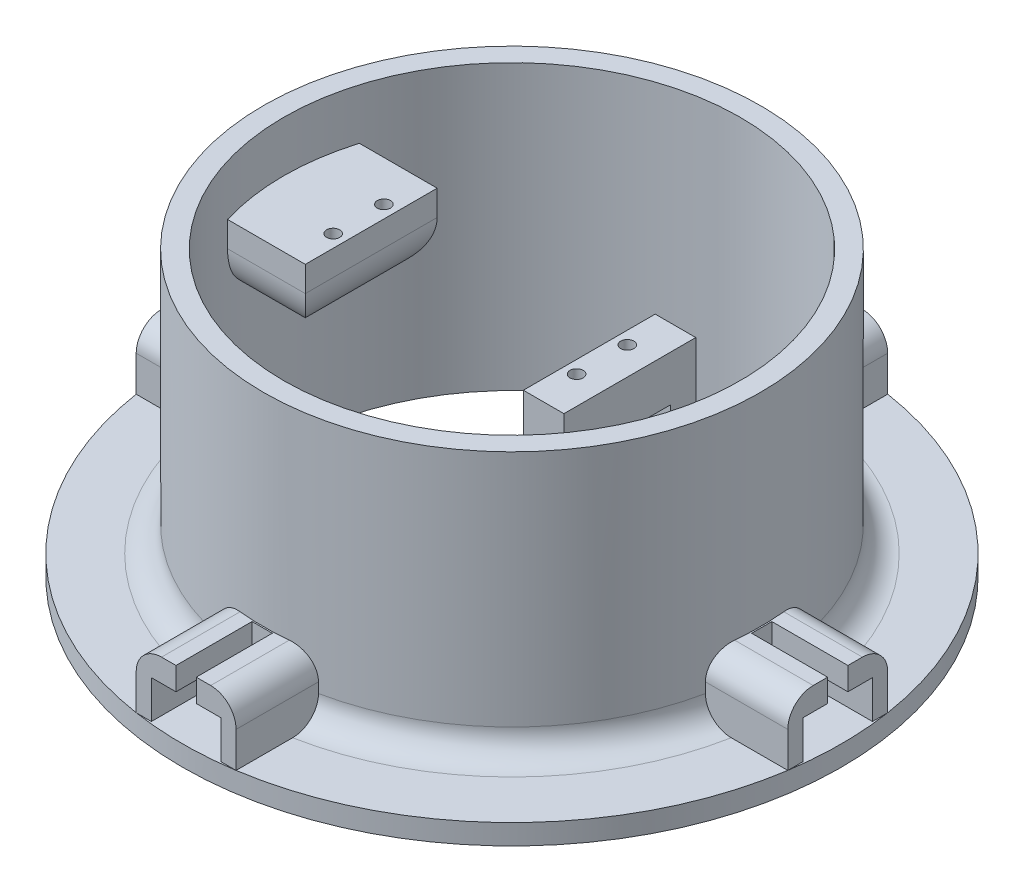
from build123d import *

# Parameters (mm, degrees)
CROQUIS1_R              = 49
CROQUIS1_R_2            = 45
SALIENTE_EXTRUIR1_DEPTH = 56
CROQUIS3_R              = 65
CROQUIS3_R_2            = 49
SALIENTE_EXTRUIR2_DEPTH = 4
REDONDEO1_R             = 5
CROQUIS4_W              = 8
CROQUIS4_H              = 26
SALIENTE_EXTRUIR3_DEPTH = 46
SALIENTE_EXTRUIR4_DEPTH = 2.2
SALIENTE_EXTRUIR5_START = -15
SALIENTE_EXTRUIR5_DEPTH = 15
REDONDEO2_R             = 10
CROQUIS7_R              = 1.3
CORTAR_EXTRUIR1_DEPTH   = 7.2
CORTAR_EXTRUIR2_REACH   = 119.478
CROQUIS8_W              = 16
CROQUIS8_H              = 34
CROQUIS9_W              = 16.249513617
CROQUIS9_H              = 19.697715604
SALIENTE_EXTRUIR6_DEPTH = 12
REDONDEO3_R             = 5
CROQUIS11_W             = 13.697715604
CROQUIS11_H             = 7.5
CORTAR_EXTRUIR3_DEPTH   = 12
CROQUIS12_W             = 4
CROQUIS12_H             = 4.5
CORTAR_EXTRUIR4_DEPTH   = 15
MATRIZC1_COUNT          = 4
REDONDEO3_OF_MATRIZC1_R = 5


with BuildPart() as part:
    # Croquis1 → Saliente-Extruir1 (new body)
    with BuildSketch(Plane(origin=(0, 0, 0), x_dir=(1, 0, 0), z_dir=(0, 1, 0))):
        with Locations(Location((0, 0, 0), (0, 0, 270))):
            Circle(CROQUIS1_R)
        with Locations(Location((0, 0, 0), (0, 0, 270))):
            Circle(CROQUIS1_R_2, mode=Mode.SUBTRACT)
    extrude(amount=SALIENTE_EXTRUIR1_DEPTH)

    # Croquis3 → Saliente-Extruir2 (add)
    with BuildSketch(Plane(origin=(0, 0, 0), x_dir=(1, 0, 0), z_dir=(0, 1, 0))):
        with Locations(Location((0, 0, 0), (0, 0, 270))):
            Circle(CROQUIS3_R)
        with Locations(Location((0, 0, 0), (0, 0, 270))):
            Circle(CROQUIS3_R_2, mode=Mode.SUBTRACT)
    extrude(amount=SALIENTE_EXTRUIR2_DEPTH)

    # Redondeo1
    redondeo1_edges = [part.edges().sort_by_distance(p)[0] for p in [
        (0, 4, -49),
    ]]
    fillet(redondeo1_edges, radius=REDONDEO1_R)



with BuildPart() as body_2:
    # Croquis4 → Saliente-Extruir3 (new body)
    with BuildSketch(Plane(origin=(0, 0, 0), x_dir=(1, 0, 0), z_dir=(0, 1, 0))):
        with Locations((19.25, 0)):
            Rectangle(CROQUIS4_W, CROQUIS4_H)
    extrude(amount=SALIENTE_EXTRUIR3_DEPTH)


with BuildPart() as part_1:
    add(part.part)

    add(body_2.part)  # Saliente-Extruir4 merges body 2
    # Croquis5 → Saliente-Extruir4 (add)
    with BuildSketch(Plane(origin=(0, 0, 0), x_dir=(1, 0, 0), z_dir=(0, 1, 0))):
        with BuildLine():
            Line((15.25, 13), (32.749541701, 30.86207249))
            ThreePointArc((32.749541701, 30.86207249), (36.011367089, 26.98483723), (38.816649113, 22.765494759))
            Line((38.816649113, 22.765494759), (27.25, 10.959224145))
            Line((27.25, 10.959224145), (27.25, -10.959224145))
            Line((27.25, -10.959224145), (38.816649113, -22.765494759))
            ThreePointArc((38.816649113, -22.765494759), (36.011367089, -26.98483723), (32.749541701, -30.86207249))
            Line((32.749541701, -30.86207249), (15.25, -13))
            Line((15.25, -13), (23.25, -13))
            Line((23.25, -13), (23.25, 13))
            Line((23.25, 13), (15.25, 13))
        make_face()
    extrude(amount=SALIENTE_EXTRUIR4_DEPTH)

    # Croquis6 → Saliente-Extruir5 (add)
    with BuildSketch(Plane(origin=(0, 46, 0), x_dir=(1, 0, 0), z_dir=(0, 1, 0)).offset(SALIENTE_EXTRUIR5_START)):
        with BuildLine():
            Line((-27.75, 13), (-43.081318457, 13))
            ThreePointArc((-43.081318457, 13), (-45, 0), (-43.081318457, -13))
            Line((-43.081318457, -13), (-27.75, -13))
            Line((-27.75, -13), (-27.75, 13))
        make_face()
    extrude(amount=SALIENTE_EXTRUIR5_DEPTH)

    # Redondeo2
    redondeo2_edges = [part_1.edges().sort_by_distance(p)[0] for p in [
        (-27.75, 31, 0),
        (-35.415659229, 31, 13),
        (-35.415659229, 31, -13),
    ]]
    fillet(redondeo2_edges, radius=REDONDEO2_R)

    # Croquis7 → Cortar-Extruir1 (cut)
    with BuildSketch(Plane(origin=(0, 46, 0), x_dir=(1, 0, 0), z_dir=(0, 1, 0))):
        with Locations(Location((17.75, 5, 0), (0, 0, 270))):
            Circle(CROQUIS7_R)
        with Locations(Location((17.75, -5, 0), (0, 0, 90))):
            Circle(CROQUIS7_R)
        with Locations(Location((-30.25, -5, 0), (0, 0, 270))):
            Circle(CROQUIS7_R)
        with Locations(Location((-30.25, 5, 0), (0, 0, 90))):
            Circle(CROQUIS7_R)
    extrude(amount=-CORTAR_EXTRUIR1_DEPTH, mode=Mode.SUBTRACT)

    # Croquis8 → Cortar-Extruir2 (cut, up to next)
    with BuildSketch(Plane.ZY.offset(-15.25), mode=Mode.PRIVATE) as cortar_extruir2_sk1:
        with Locations((0, 20)):
            Rectangle(CROQUIS8_W, CROQUIS8_H)
    cortar_extruir2_tool1 = extrude(cortar_extruir2_sk1.sketch, amount=-CORTAR_EXTRUIR2_REACH, mode=Mode.PRIVATE) & part_1.part
    add(cortar_extruir2_tool1.solids().sort_by_distance((15.25, 20, 0))[0], mode=Mode.SUBTRACT)

    # Croquis9 → Saliente-Extruir6 (add)
    with BuildSketch(Plane(origin=(0, 4, 0), x_dir=(1, 0, 0), z_dir=(0, 1, 0))):
        with Locations((-56.124756809, 0)):
            Rectangle(CROQUIS9_W, CROQUIS9_H)
    saliente_extruir6 = extrude(amount=SALIENTE_EXTRUIR6_DEPTH)

    # Redondeo3
    redondeo3_edges = [part_1.edges().sort_by_distance(p)[0] for p in [
        (-56.124756808, 16, -9.848857802),
        (-56.124756808, 16, 9.848857802),
    ]]
    fillet(redondeo3_edges, radius=REDONDEO3_R)

    # Croquis11 → Cortar-Extruir3 (cut)
    with BuildSketch(Plane.ZY.offset(64.249513617)):
        with Locations((0, 7.75)):
            Rectangle(CROQUIS11_W, CROQUIS11_H)
    cortar_extruir3 = extrude(amount=-CORTAR_EXTRUIR3_DEPTH, mode=Mode.SUBTRACT)

    # Croquis12 → Cortar-Extruir4 (cut)
    with BuildSketch(Plane.ZY.offset(64.249513617)):
        with Locations((0, 13.75)):
            Rectangle(CROQUIS12_W, CROQUIS12_H)
    cortar_extruir4 = extrude(amount=-CORTAR_EXTRUIR4_DEPTH, mode=Mode.SUBTRACT)

    # MatrizC1: Saliente-Extruir6, Cortar-Extruir3, Cortar-Extruir4 ×4 about axis
    matrizc1_axis = Axis((0, 0, 0), (0, 1, 0))
    add([saliente_extruir6.rotate(matrizc1_axis, i * 360 / MATRIZC1_COUNT) for i in range(1, MATRIZC1_COUNT)])
    add([cortar_extruir3.rotate(matrizc1_axis, i * 360 / MATRIZC1_COUNT) for i in range(1, MATRIZC1_COUNT)], mode=Mode.SUBTRACT)
    add([cortar_extruir4.rotate(matrizc1_axis, i * 360 / MATRIZC1_COUNT) for i in range(1, MATRIZC1_COUNT)], mode=Mode.SUBTRACT)

    # Redondeo3 of MatrizC1
    redondeo3_of_matrizc1_edges = [part_1.edges().sort_by_distance(p)[0] for p in [
        (-9.848857802, 16, 56.124756808),
        (9.848857802, 16, 56.124756808),
        (56.124756808, 16, 9.848857802),
        (56.124756808, 16, -9.848857802),
        (9.848857802, 16, -56.124756808),
        (-9.848857802, 16, -56.124756808),
    ]]
    fillet(redondeo3_of_matrizc1_edges, radius=REDONDEO3_OF_MATRIZC1_R)


solid = part_1.part
